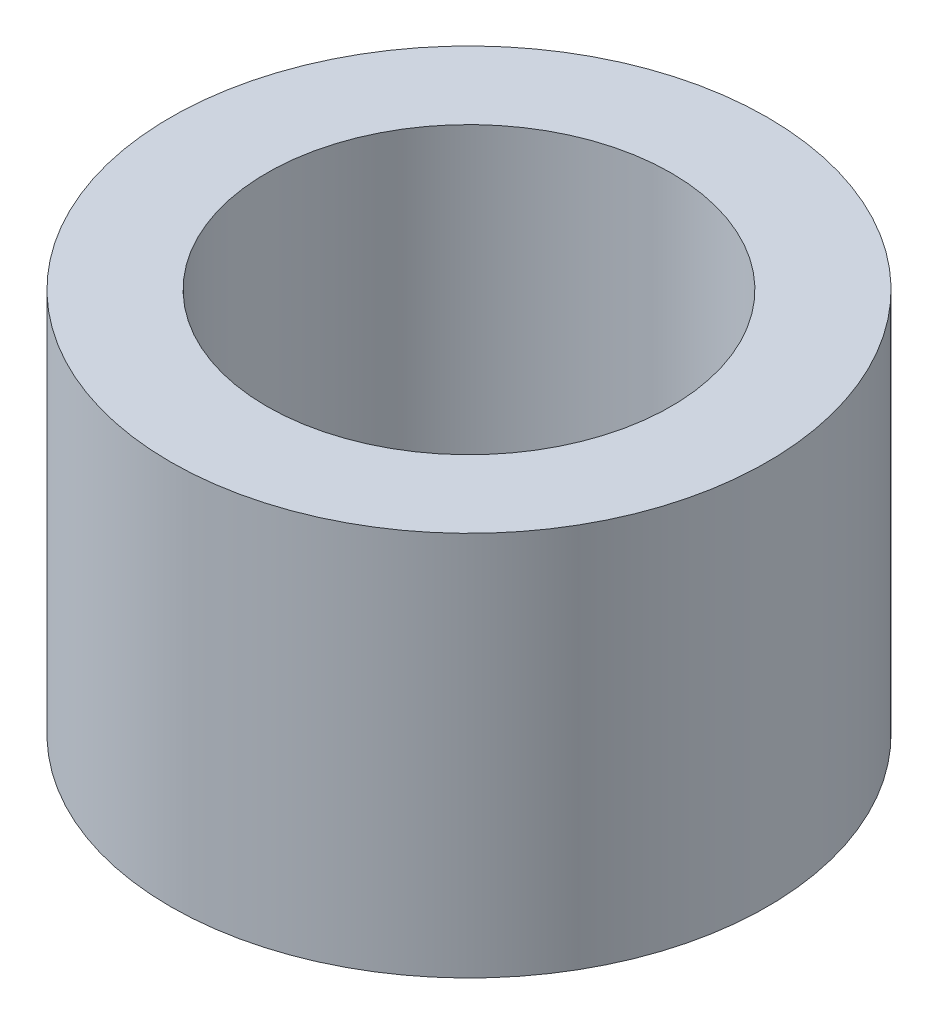
from build123d import *

# Parameters (mm, degrees)
SKETCH1_R           = 3.937
SKETCH1_R_2         = 2.667
BOSS_EXTRUDE1_DEPTH = 5.08


with BuildPart() as part:
    # Sketch1 → Boss-Extrude1 (new body)
    with BuildSketch(Plane(origin=(0, 0, 0), x_dir=(1, 0, 0), z_dir=(0, 1, 0))):
        with Locations(Location((0, 0, 0), (0, 0, 270))):
            Circle(SKETCH1_R)
        with Locations(Location((0, 0, 0), (0, 0, 270))):
            Circle(SKETCH1_R_2, mode=Mode.SUBTRACT)
    extrude(amount=BOSS_EXTRUDE1_DEPTH)


solid = part.part
